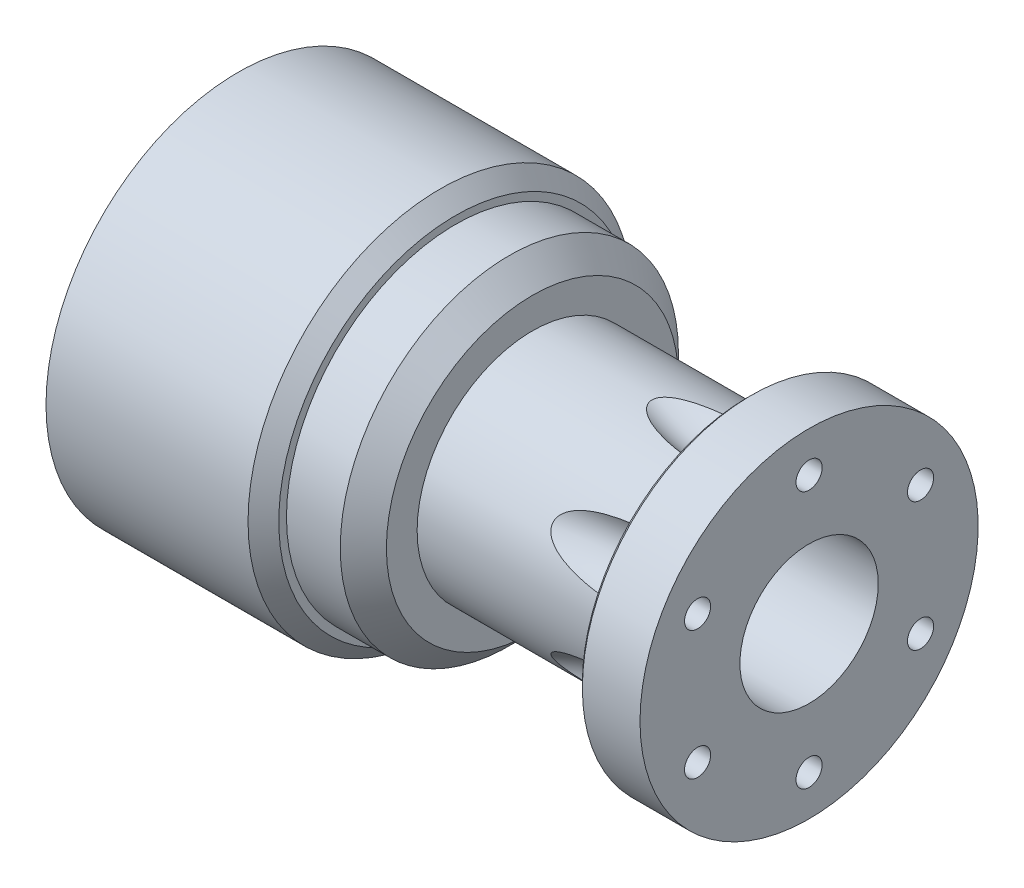
from build123d import *

# Parameters (mm, degrees)
CUT_EXTRUDE_1_REACH      = 84.274
SKETCH_2_R               = 9
SKETCH_5_R               = 4.5
PATTERN_CIRCULAR_1_COUNT = 6
PATTERN_CIRCULAR_2_COUNT = 6
CHAMFER_1_SIZE           = 2
CHAMFER_2_SIZE           = 3
CHAMFER_3_SIZE           = 0.5


with BuildPart() as part:
    # 草图1 → 旋转1 (revolve)
    with BuildSketch(Plane.XY):
        Polygon((0, 0), (0, 25), (28.29, 25), (28.29, 22), (38.29, 22), (38.29, 15), (66.29, 15), (66.29, 22), (74.29, 22), (74.29, 0), align=None)
    revolve(axis=Axis((-39.205856293, 0, 0), (1, 0, 0)))

    # 草图2 → 切除-拉伸1 (cut, up to next)
    with BuildSketch(Plane(origin=(74.29, 0, 0), x_dir=(0, 0, -1), z_dir=(1, 0, 0)), mode=Mode.PRIVATE) as cut_extrude_1_sk1:
        Circle(SKETCH_2_R)
    cut_extrude_1_tool1 = extrude(cut_extrude_1_sk1.sketch, amount=-CUT_EXTRUDE_1_REACH, mode=Mode.PRIVATE) & part.part
    add(cut_extrude_1_tool1.solids().sort_by_distance((74.29, 0, 0))[0], mode=Mode.SUBTRACT)

    # 草图3 → 打孔尺寸(%根据六角头螺)栓 全螺纹的类型1 (revolve, cut)
    with BuildSketch(Plane(origin=(66.29, 16.75, 0), x_dir=(0, 0, 1), z_dir=(0, 1, 0))):
        Polygon((0, 0), (0, 8), (1.7, 8), (1.7, 5), (4.5, 5), (4.5, 0), align=None)
    hole_wizard_1 = revolve(axis=Axis((59.94, 16.75, 0), (1, 0, 0)), mode=Mode.SUBTRACT)

    # 切除-扫描2: sweep along a path in 草图6
    with BuildLine(Plane.XY) as sweep_2_path:
        ThreePointArc((66.29, 16.75), (51.18385823, 21.830048172), (42.216910691, 35.005641534))
    # 草图5 → 切除-扫描2 (sweep, cut)
    with BuildSketch(Plane.ZY.offset(-66.29)):
        with Locations((0, 16.75)):
            Circle(SKETCH_5_R)
    sweep_2 = sweep(path=sweep_2_path.line, mode=Mode.SUBTRACT)

    # 阵列(圆周)1: 打孔尺寸(%根据六角头螺)栓 全螺纹的类型1, 切除-扫描2 ×6 about axis
    pattern_circular_1_axis = Axis((0, 0, 0), (1, 0, 0))
    add([hole_wizard_1.rotate(pattern_circular_1_axis, i * 360 / PATTERN_CIRCULAR_1_COUNT) for i in range(1, PATTERN_CIRCULAR_1_COUNT)], mode=Mode.SUBTRACT)
    add([sweep_2.rotate(pattern_circular_1_axis, i * 360 / PATTERN_CIRCULAR_1_COUNT) for i in range(1, PATTERN_CIRCULAR_1_COUNT)], mode=Mode.SUBTRACT)

    # 草图9 → M4 螺纹孔1 (revolve, cut)
    with BuildSketch(Plane.ZX.offset(17.5)):
        Polygon((0, 0), (0, 7.591420021), (1.65, 6.6), (1.65, 0), align=None)
    hole_wizard_m4_1 = revolve(axis=Axis((-6.35, 17.5, 0), (1, 0, 0)), mode=Mode.SUBTRACT)

    # 阵列(圆周)2: M4 螺纹孔1 ×6 about axis
    pattern_circular_2_axis = Axis((0, 0, 0), (1, 0, 0))
    for i in range(1, PATTERN_CIRCULAR_2_COUNT):
        add(hole_wizard_m4_1.rotate(pattern_circular_2_axis, i * 360 / PATTERN_CIRCULAR_2_COUNT), mode=Mode.SUBTRACT)

    # 倒角1
    chamfer_1_edges = [part.edges().sort_by_distance(p)[0] for p in [
        (28.29, -25, 0),
    ]]
    chamfer(chamfer_1_edges, length=CHAMFER_1_SIZE)

    # 倒角2
    chamfer_2_edges = [part.edges().sort_by_distance(p)[0] for p in [
        (38.29, -22, 0),
    ]]
    chamfer(chamfer_2_edges, length=CHAMFER_2_SIZE)

    # 倒角3
    chamfer_3_edges = [part.edges().sort_by_distance(p)[0] for p in [
        (66.29, -22, 0),
    ]]
    chamfer(chamfer_3_edges, length=CHAMFER_3_SIZE)


solid = part.part
